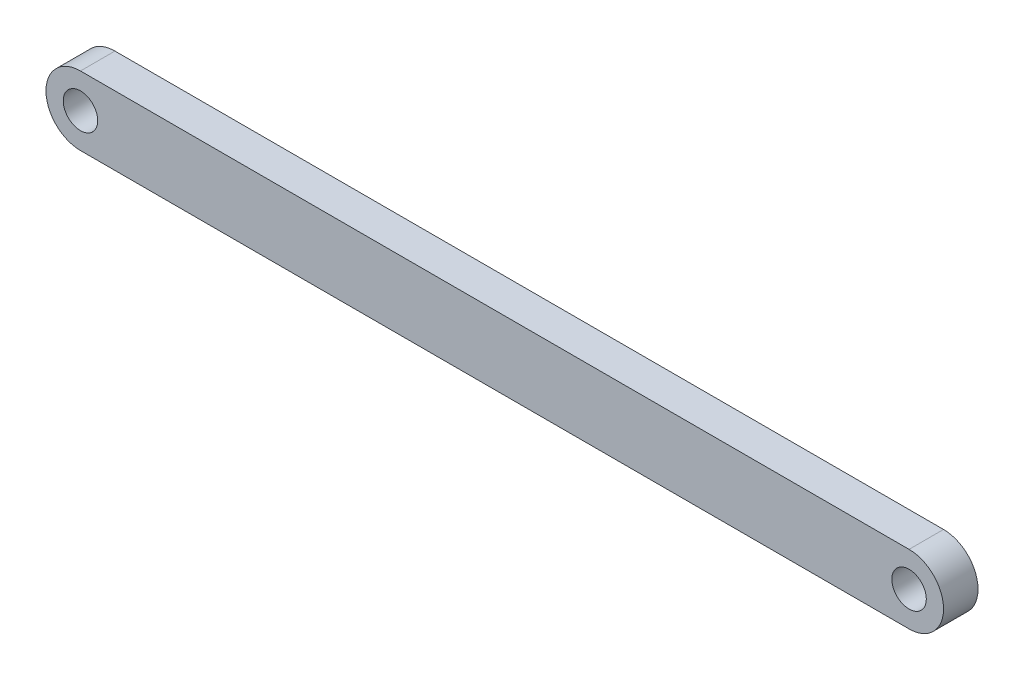
from build123d import *

# Parameters (mm, degrees)
SKETCH_1_R      = 1
EXTRUDE_1_DEPTH = 2


with BuildPart() as part:
    # 草圖1 → 填料-伸長1 (new body)
    with BuildSketch(Plane.XY):
        with BuildLine():
            Line((-24.039999968, 2.001240404), (24.040000032, 2.001240404))
            ThreePointArc((24.040000032, 2.001240404), (26.040000032, 0.001240404), (24.040000032, -1.998759596))
            Line((24.040000032, -1.998759596), (-24.039999968, -1.998759596))
            ThreePointArc((-24.039999968, -1.998759596), (-26.039999968, 0.001240404), (-24.039999968, 2.001240404))
        make_face()
        with Locations((-24.039999968, 0.001240404)):
            Circle(SKETCH_1_R, mode=Mode.SUBTRACT)
        with Locations((24.040000032, 0.001240404)):
            Circle(SKETCH_1_R, mode=Mode.SUBTRACT)
    extrude(amount=EXTRUDE_1_DEPTH)


solid = part.part
